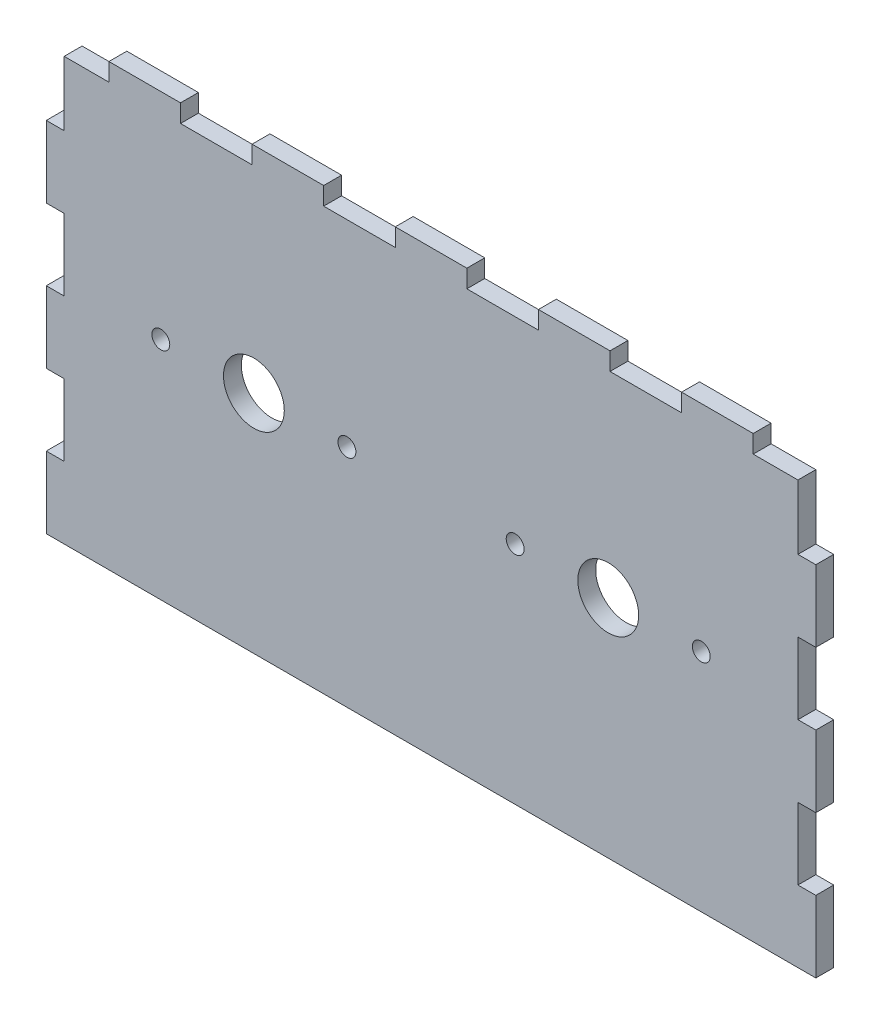
from build123d import *

# Parameters (mm, degrees)
SKETCH_1_W               = 205
SKETCH_1_H               = 118
SKETCH_1_R               = 8.5
SKETCH_1_R_2             = 2.5
EXTRUDE_1_DEPTH          = 5
SKETCH_2_W               = 5
SKETCH_2_H               = 20
EXTRUDE_2_DEPTH          = 5
PATTERN_LINEAR_1_COUNT   = 3
PATTERN_LINEAR_1_PITCH   = 40
MIRROR_1_COPY_1_SKETCH_W = 5
MIRROR_1_COPY_1_SKETCH_H = 20
MIRROR_1_COPY_1_DEPTH    = 5
MIRROR_1_COPY_2_SKETCH_W = 5
MIRROR_1_COPY_2_SKETCH_H = 20
MIRROR_1_COPY_2_DEPTH    = 5
SKETCH_3_W               = 20
SKETCH_3_H               = 5
EXTRUDE_3_DEPTH          = 5
PATTERN_LINEAR_2_COUNT   = 3
PATTERN_LINEAR_2_PITCH   = 40
PATTERN_LINEAR_3_COUNT   = 3
PATTERN_LINEAR_3_PITCH   = 40


with BuildPart() as part:
    # 스케치1 → 보스-돌출1 (new body)
    with BuildSketch(Plane.XY):
        Rectangle(SKETCH_1_W, SKETCH_1_H)
        with Locations((49.5, 4)):
            Circle(SKETCH_1_R, mode=Mode.SUBTRACT)
        with Locations((-49.5, 4)):
            Circle(SKETCH_1_R, mode=Mode.SUBTRACT)
        with Locations((-75.5, 4)):
            Circle(SKETCH_1_R_2, mode=Mode.SUBTRACT)
        with Locations(Location((-23.5, 4, 0), (0, 0, 180))):
            Circle(SKETCH_1_R_2, mode=Mode.SUBTRACT)
        with Locations((23.5, 4)):
            Circle(SKETCH_1_R_2, mode=Mode.SUBTRACT)
        with Locations(Location((75.5, 4, 0), (0, 0, 180))):
            Circle(SKETCH_1_R_2, mode=Mode.SUBTRACT)
    extrude(amount=EXTRUDE_1_DEPTH)

    # 스케치2 → 보스-돌출2 (add)
    with BuildSketch(Plane.XY.offset(5)):
        with Locations((-105, -49)):
            Rectangle(SKETCH_2_W, SKETCH_2_H)
    extrude_2 = extrude(amount=-EXTRUDE_2_DEPTH)

    # 선형 패턴1: 보스-돌출2 ×3
    with Locations(*[(0, i * PATTERN_LINEAR_1_PITCH, 0) for i in range(1, PATTERN_LINEAR_1_COUNT)]):
        add(extrude_2)

    # 대칭 복사1: 보스-돌출2 across plane
    add(extrude_2.mirror(Plane(origin=(0, 0, 0), x_dir=(0, 0, 1), z_dir=(1, 0, 0))))

    # 대칭 복사1 copy 1 sketch → 대칭 복사1 copy 1 (add)
    with BuildSketch(Plane(origin=(0, 40, 5), x_dir=(-1, 0, 0), z_dir=(0, 0, 1))):
        with Locations((-105, 49)):
            Rectangle(MIRROR_1_COPY_1_SKETCH_W, MIRROR_1_COPY_1_SKETCH_H)
    extrude(amount=-MIRROR_1_COPY_1_DEPTH)

    # 대칭 복사1 copy 2 sketch → 대칭 복사1 copy 2 (add)
    with BuildSketch(Plane(origin=(0, 80, 5), x_dir=(-1, 0, 0), z_dir=(0, 0, 1))):
        with Locations((-105, 49)):
            Rectangle(MIRROR_1_COPY_2_SKETCH_W, MIRROR_1_COPY_2_SKETCH_H)
    extrude(amount=-MIRROR_1_COPY_2_DEPTH)

    # 스케치3 → 보스-돌출3 (add)
    with BuildSketch(Plane.XY.offset(5)):
        with Locations((0, 61.5)):
            Rectangle(SKETCH_3_W, SKETCH_3_H)
    extrude_3 = extrude(amount=-EXTRUDE_3_DEPTH)

    # 선형 패턴2: 보스-돌출3 ×3
    with Locations(*[(i * PATTERN_LINEAR_2_PITCH, 0, 0) for i in range(1, PATTERN_LINEAR_2_COUNT)]):
        add(extrude_3)

    # 선형 패턴3: 보스-돌출3 ×3
    with Locations(*[(-i * PATTERN_LINEAR_3_PITCH, 0, 0) for i in range(1, PATTERN_LINEAR_3_COUNT)]):
        add(extrude_3)


solid = part.part
